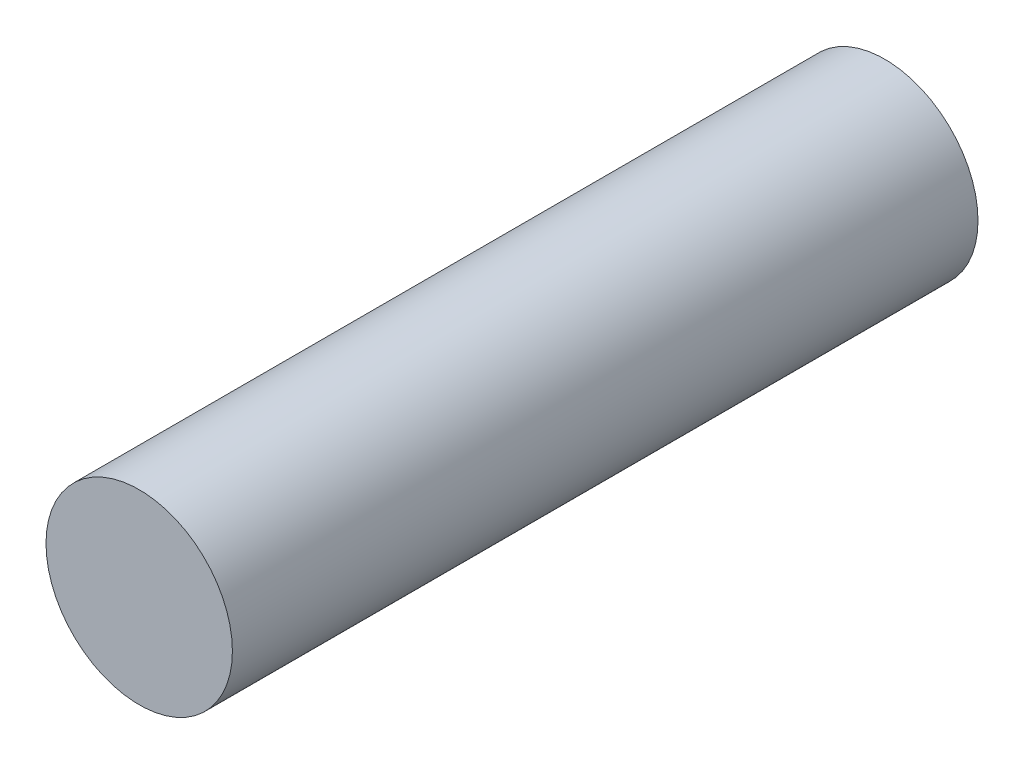
from build123d import *

# Parameters (mm, degrees)
SKETCH1_R           = 4
BOSS_EXTRUDE1_DEPTH = 32


with BuildPart() as part:
    # Sketch1 → Boss-Extrude1 (new body)
    with BuildSketch(Plane.XY):
        Circle(SKETCH1_R)
    extrude(amount=BOSS_EXTRUDE1_DEPTH)


solid = part.part
